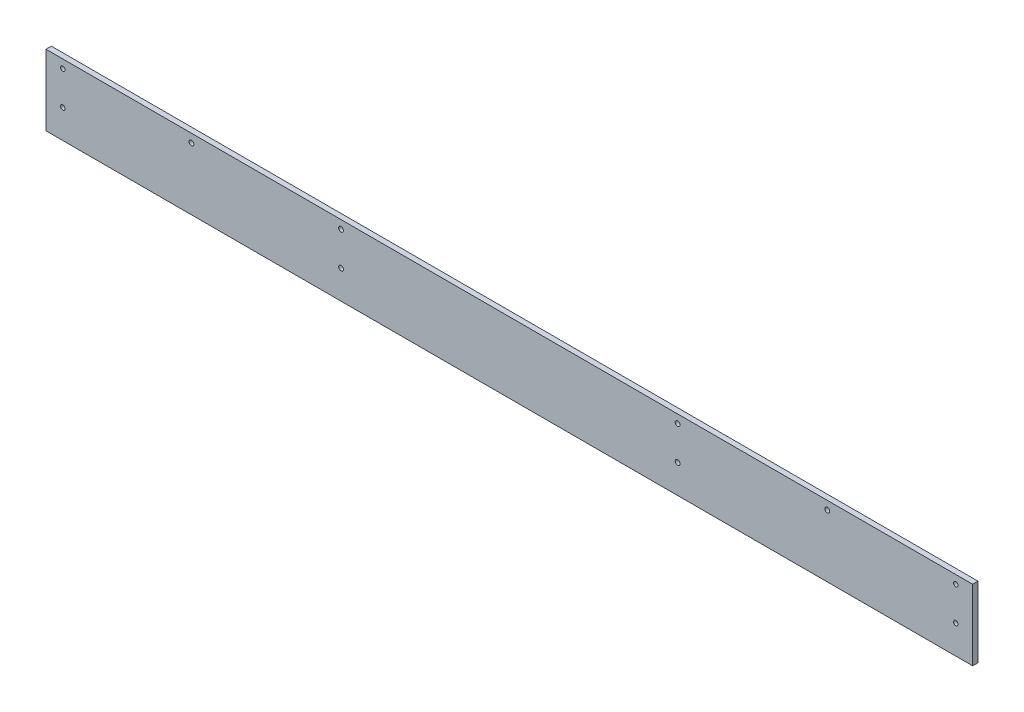
from build123d import *

# Parameters (mm, degrees)
SKETCH3_W               = 550.7
SKETCH3_H               = 30
BOSS_EXTRUDE3_DEPTH     = 3.18
CUT_EXTRUDE1_REACH      = 277.777
SKETCH4_R               = 1.35
MIRROR2_COPY_1_REACH    = 277.777
MIRROR2_COPY_1_SKETCH_R = 1.35
CUT_EXTRUDE2_REACH      = 277.777
SKETCH5_R               = 1.425
MIRROR4_COPY_1_REACH    = 277.777
MIRROR4_COPY_1_SKETCH_R = 1.425
SKETCH6_W               = 550.7
SKETCH6_H               = 3.18
BOSS_EXTRUDE4_DEPTH     = 12
CUT_EXTRUDE3_REACH      = 278.689
SKETCH7_R               = 1.45


with BuildPart() as part:
    # Sketch3 → Boss-Extrude3 (new body)
    with BuildSketch(Plane.XY):
        Rectangle(SKETCH3_W, SKETCH3_H)
    extrude(amount=BOSS_EXTRUDE3_DEPTH)

    # Sketch4 → Cut-Extrude1 (cut, up to next)
    with BuildSketch(Plane.XY.offset(3.18), mode=Mode.PRIVATE) as cut_extrude1_sk1:
        with Locations((265.35, 10)):
            Circle(SKETCH4_R)
    cut_extrude1_tool1 = extrude(cut_extrude1_sk1.sketch, amount=-CUT_EXTRUDE1_REACH, mode=Mode.PRIVATE) & part.part
    cut_extrude1 = cut_extrude1_tool1.solids().sort_by_distance((265.35, 10, 3.18))[0]
    add(cut_extrude1, mode=Mode.SUBTRACT)

    # Mirror1: Cut-Extrude1 across plane
    add(cut_extrude1.mirror(Plane.ZX), mode=Mode.SUBTRACT)

    # Mirror2: Cut-Extrude1 across plane
    add(cut_extrude1.mirror(Plane(origin=(0, 0, 0), x_dir=(0, 0, 1), z_dir=(1, 0, 0))), mode=Mode.SUBTRACT)

    # Mirror2 copy 1 sketch → Mirror2 copy 1 (cut, up to next)
    with BuildSketch(Plane(origin=(0, 0, 3.18), x_dir=(-1, 0, 0), z_dir=(0, 0, 1)), mode=Mode.PRIVATE) as mirror2_copy_1_sk1:
        with Locations((265.35, 10)):
            Circle(MIRROR2_COPY_1_SKETCH_R)
    mirror2_copy_1_tool1 = extrude(mirror2_copy_1_sk1.sketch, amount=-MIRROR2_COPY_1_REACH, mode=Mode.PRIVATE) & part.part
    add(mirror2_copy_1_tool1.solids().sort_by_distance((-265.35, -10, 3.18))[0], mode=Mode.SUBTRACT)

    # Sketch5 → Cut-Extrude2 (cut, up to next)
    with BuildSketch(Plane.XY.offset(3.18), mode=Mode.PRIVATE) as cut_extrude2_sk1:
        with Locations((100, -10)):
            Circle(SKETCH5_R)
    cut_extrude2_tool1 = extrude(cut_extrude2_sk1.sketch, amount=-CUT_EXTRUDE2_REACH, mode=Mode.PRIVATE) & part.part
    cut_extrude2 = cut_extrude2_tool1.solids().sort_by_distance((100, -10, 3.18))[0]
    add(cut_extrude2, mode=Mode.SUBTRACT)

    # Mirror3: Cut-Extrude2 across plane
    add(cut_extrude2.mirror(Plane(origin=(0, 0, 0), x_dir=(0, 0, 1), z_dir=(1, 0, 0))), mode=Mode.SUBTRACT)

    # Mirror4: Cut-Extrude2 across plane
    add(cut_extrude2.mirror(Plane.ZX), mode=Mode.SUBTRACT)

    # Mirror4 copy 1 sketch → Mirror4 copy 1 (cut, up to next)
    with BuildSketch(Plane(origin=(0, 0, 3.18), x_dir=(-1, 0, 0), z_dir=(0, 0, 1)), mode=Mode.PRIVATE) as mirror4_copy_1_sk1:
        with Locations((100, -10)):
            Circle(MIRROR4_COPY_1_SKETCH_R)
    mirror4_copy_1_tool1 = extrude(mirror4_copy_1_sk1.sketch, amount=-MIRROR4_COPY_1_REACH, mode=Mode.PRIVATE) & part.part
    add(mirror4_copy_1_tool1.solids().sort_by_distance((-100, 10, 3.18))[0], mode=Mode.SUBTRACT)

    # Sketch6 → Boss-Extrude4 (add)
    with BuildSketch(Plane.XZ.offset(15)):
        with Locations((0, 1.59)):
            Rectangle(SKETCH6_W, SKETCH6_H)
    extrude(amount=BOSS_EXTRUDE4_DEPTH)

    # Sketch7 → Cut-Extrude3 (cut, up to next)
    with BuildSketch(Plane.XY.offset(3.18), mode=Mode.PRIVATE) as cut_extrude3_sk1:
        with Locations((-188.94, 10)):
            Circle(SKETCH7_R)
    cut_extrude3_tool1 = extrude(cut_extrude3_sk1.sketch, amount=-CUT_EXTRUDE3_REACH, mode=Mode.PRIVATE) & part.part
    cut_extrude3 = cut_extrude3_tool1.solids().sort_by_distance((-188.94, 10, 3.18))[0]
    add(cut_extrude3, mode=Mode.SUBTRACT)

    # Mirror5: Cut-Extrude3 across plane
    add(cut_extrude3.mirror(Plane(origin=(0, 0, 0), x_dir=(0, 0, 1), z_dir=(1, 0, 0))), mode=Mode.SUBTRACT)


solid = part.part
